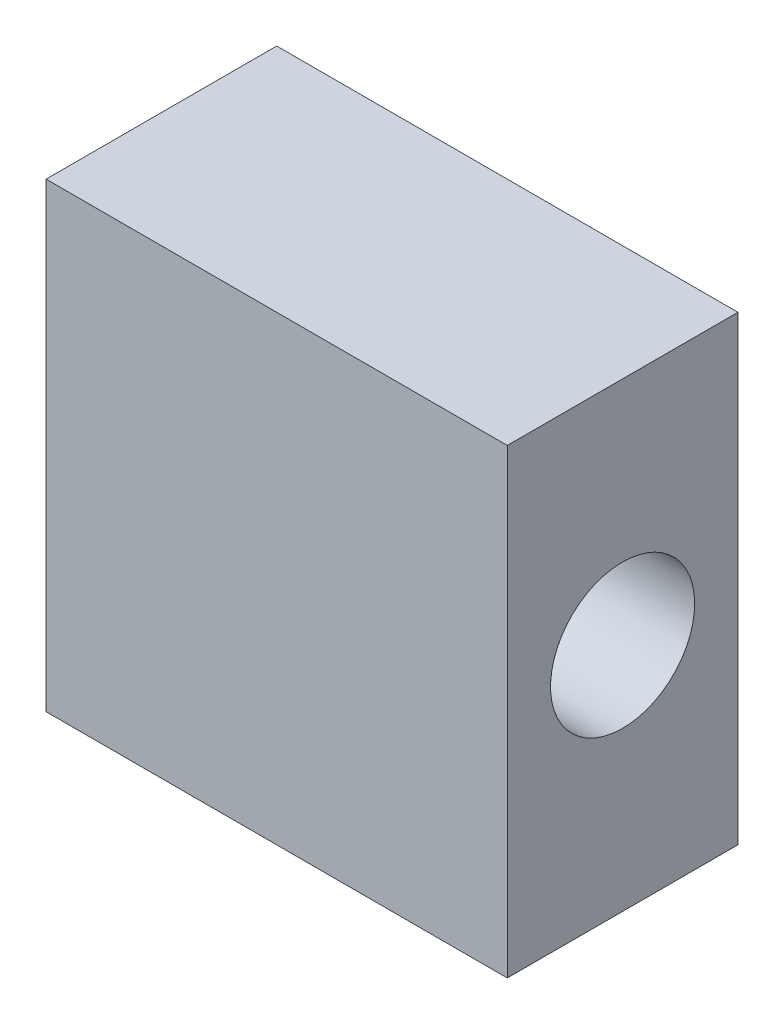
from build123d import *

# Parameters (mm, degrees)
SKETCH1_W           = 50.8
SKETCH1_H           = 50.8
BOSS_EXTRUDE1_DEPTH = 25.4
SKETCH2_R           = 7.9375
CUT_EXTRUDE1_DEPTH  = 25.4


with BuildPart() as part:
    # Sketch1 → Boss-Extrude1 (new body)
    with BuildSketch(Plane.XY):
        with Locations((25.4, 25.4)):
            Rectangle(SKETCH1_W, SKETCH1_H)
    extrude(amount=BOSS_EXTRUDE1_DEPTH)

    # Sketch2 → Cut-Extrude1 (cut)
    with BuildSketch(Plane(origin=(50.8, 0, 0), x_dir=(0, 0, -1), z_dir=(1, 0, 0))):
        with Locations((-12.7, 25.4)):
            Circle(SKETCH2_R)
    extrude(amount=-CUT_EXTRUDE1_DEPTH, mode=Mode.SUBTRACT)


solid = part.part
